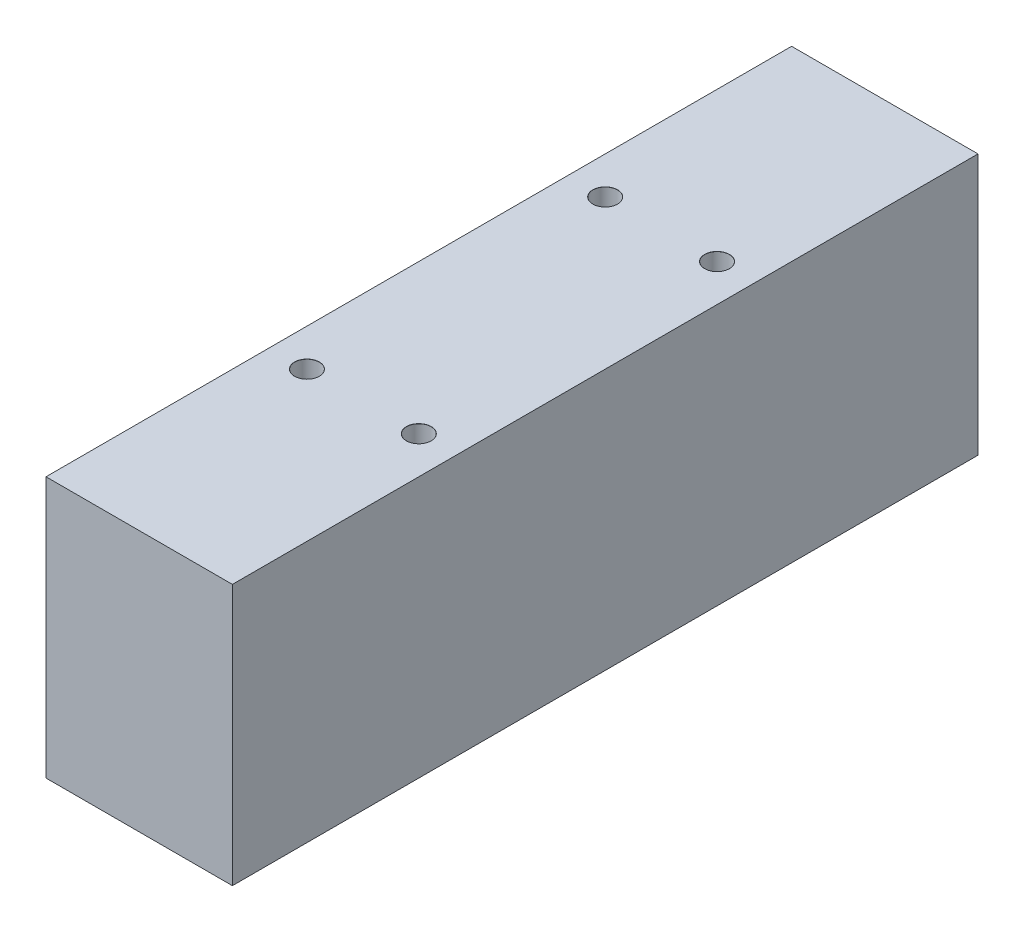
from build123d import *

# Parameters (mm, degrees)
SKETCH1_W                      = 50
SKETCH1_H                      = 200
BOSS_EXTRUDE1_DEPTH            = 70
M6_CLEARANCE_HOLE1_D           = 6.6
M6_CLEARANCE_HOLE1_DEPTH       = 3.017159957
M6_CLEARANCE_HOLE1_CSINK_D     = 6.65
M6_CLEARANCE_HOLE1_CSINK_ANGLE = 100
M6_CLEARANCE_HOLE1_TIP         = 1.982840043
SKETCH5_R                      = 10
SKETCH5_R_2                    = 18.5
CUT_EXTRUDE1_DEPTH             = 40
M6_CLEARANCE_HOLE2_D           = 6.6
M6_CLEARANCE_HOLE2_CSINK_D     = 6.65
M6_CLEARANCE_HOLE2_CSINK_ANGLE = 100


with BuildPart() as part:
    # Sketch1 → Boss-Extrude1 (new body)
    with BuildSketch(Plane(origin=(0, 0, 0), x_dir=(1, 0, 0), z_dir=(0, 1, 0))):
        Rectangle(SKETCH1_W, SKETCH1_H)
    extrude(amount=BOSS_EXTRUDE1_DEPTH)

    # M6 Clearance Hole1
    with Locations(Plane(origin=(0, 0, 0), x_dir=(-1, 0, 0), z_dir=(0, -1, 0))):
        with Locations((0, 75), (0, 0), (0, -75)):
            CounterSinkHole(M6_CLEARANCE_HOLE1_D / 2, M6_CLEARANCE_HOLE1_CSINK_D / 2, depth=M6_CLEARANCE_HOLE1_DEPTH, counter_sink_angle=M6_CLEARANCE_HOLE1_CSINK_ANGLE)
            with Locations((0, 0, -(M6_CLEARANCE_HOLE1_DEPTH + M6_CLEARANCE_HOLE1_TIP / 2))):  # 118° drill point
                Cone(0, M6_CLEARANCE_HOLE1_D / 2, M6_CLEARANCE_HOLE1_TIP, mode=Mode.SUBTRACT)

    # Sketch5 → Cut-Extrude1 (cut)
    with BuildSketch(Plane.ZY.offset(25)):
        with Locations((-60, 40)):
            Circle(SKETCH5_R)
        with Locations((60, 40)):
            Circle(SKETCH5_R)
        with Locations((0, 40)):
            Circle(SKETCH5_R_2)
    extrude(amount=-CUT_EXTRUDE1_DEPTH, mode=Mode.SUBTRACT)

    # M6 Clearance Hole2 (through all)
    with Locations(Plane(origin=(0, 70, 0), x_dir=(1, 0, 0), z_dir=(0, 1, 0))):
        with Locations((-15, 40), (15, 40), (-15, -40), (15, -40)):
            CounterSinkHole(M6_CLEARANCE_HOLE2_D / 2, M6_CLEARANCE_HOLE2_CSINK_D / 2, counter_sink_angle=M6_CLEARANCE_HOLE2_CSINK_ANGLE)


solid = part.part
